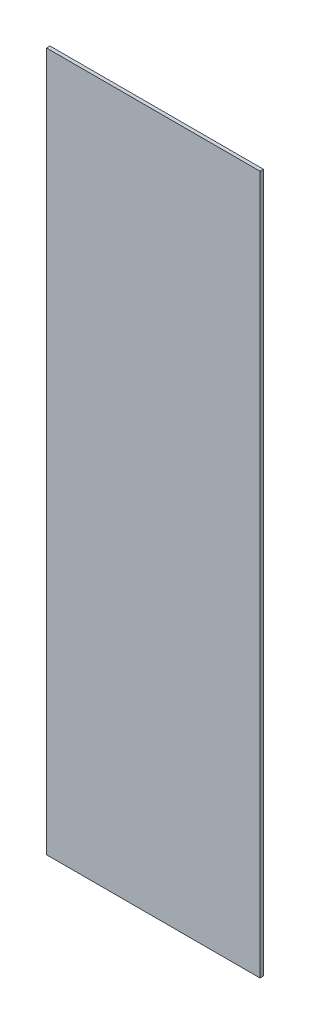
from build123d import *

# Parameters (mm, degrees)
SKETCH_1_W      = 124
SKETCH_1_H      = 406
EXTRUDE_1_DEPTH = 2


with BuildPart() as part:
    # 草图1 → 凸台-拉伸1 (new body)
    with BuildSketch(Plane.XY):
        Rectangle(SKETCH_1_W, SKETCH_1_H)
    extrude(amount=EXTRUDE_1_DEPTH)


solid = part.part
